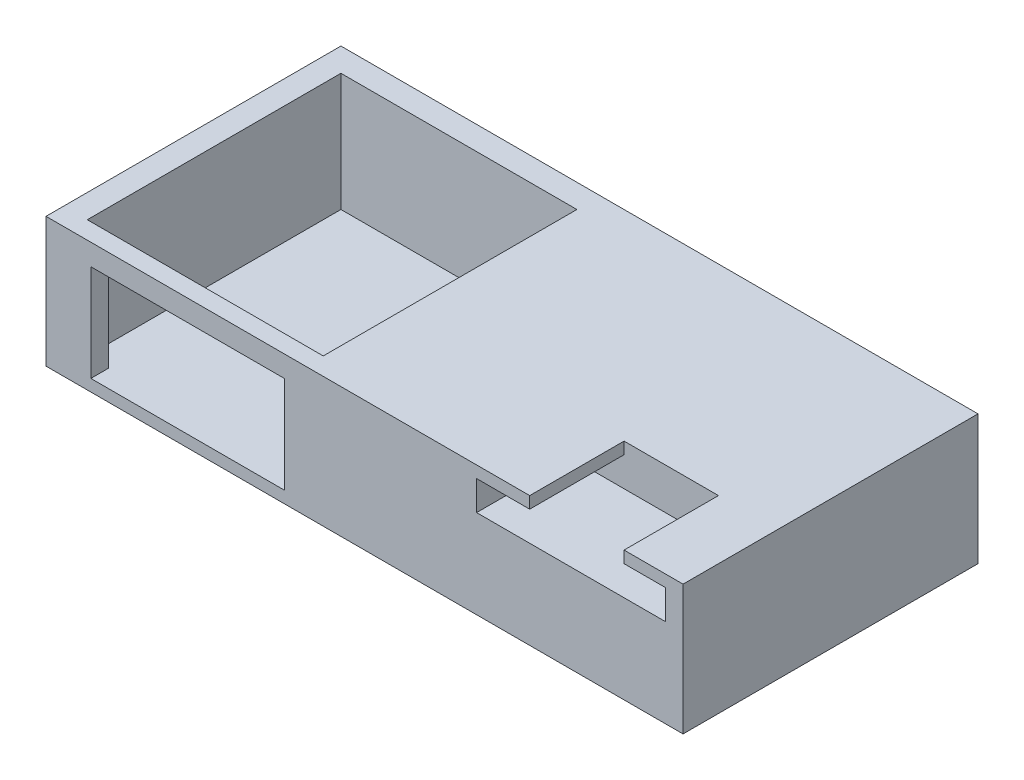
from build123d import *

# Parameters (mm, degrees)
SKETCH8_W            = 54
SKETCH8_H            = 25
BOSS_EXTRUDE1_DEPTH  = 11
SKETCH9_W            = 20
SKETCH9_H            = 21.5
CUT_EXTRUDE1_DEPTH   = 10
SKETCH11_W           = 8
SKETCH11_H           = 8
CUT_EXTRUDE5_DEPTH   = 3.5
JOYSTICK_ENTRY_REACH = 40.406
SKETCH10_W           = 16.4
SKETCH10_H           = 8.2
SKETCH13_W           = 16
SKETCH13_H           = 2.5
CUT_EXTRUDE6_DEPTH   = 8


with BuildPart() as part:
    # Sketch8 → Boss-Extrude1 (new body)
    with BuildSketch(Plane(origin=(0, 0, 0), x_dir=(1, 0, 0), z_dir=(0, 1, 0))):
        with Locations((0, 13)):
            Rectangle(SKETCH8_W, SKETCH8_H)
    extrude(amount=BOSS_EXTRUDE1_DEPTH)

    # Sketch9 → Cut-Extrude1 (cut)
    with BuildSketch(Plane(origin=(0, 11, 0), x_dir=(1, 0, 0), z_dir=(0, 1, 0))):
        with Locations((-15, 12.75)):
            Rectangle(SKETCH9_W, SKETCH9_H)
    extrude(amount=-CUT_EXTRUDE1_DEPTH, mode=Mode.SUBTRACT)

    # Sketch11 → Cut-Extrude5 (cut)
    with BuildSketch(Plane(origin=(0, 11, 0), x_dir=(1, 0, 0), z_dir=(0, 1, 0))):
        with Locations((18, 4.5)):
            Rectangle(SKETCH11_W, SKETCH11_H)
    extrude(amount=-CUT_EXTRUDE5_DEPTH, mode=Mode.SUBTRACT)

    # Sketch10 → Joystick Entry (cut, up to next)
    with BuildSketch(Plane.XY.offset(-0.5), mode=Mode.PRIVATE) as joystick_entry_sk1:
        with Locations((-15, 5.1)):
            Rectangle(SKETCH10_W, SKETCH10_H)
    joystick_entry_tool1 = extrude(joystick_entry_sk1.sketch, amount=-JOYSTICK_ENTRY_REACH, mode=Mode.PRIVATE) & part.part
    add(joystick_entry_tool1.solids().sort_by_distance((-15, 5.1, -0.5))[0], mode=Mode.SUBTRACT)

    # Sketch13 → Cut-Extrude6 (cut)
    with BuildSketch(Plane.XY.offset(-0.5)):
        with Locations((17.5, 8.75)):
            Rectangle(SKETCH13_W, SKETCH13_H)
    extrude(amount=-CUT_EXTRUDE6_DEPTH, mode=Mode.SUBTRACT)


solid = part.part
